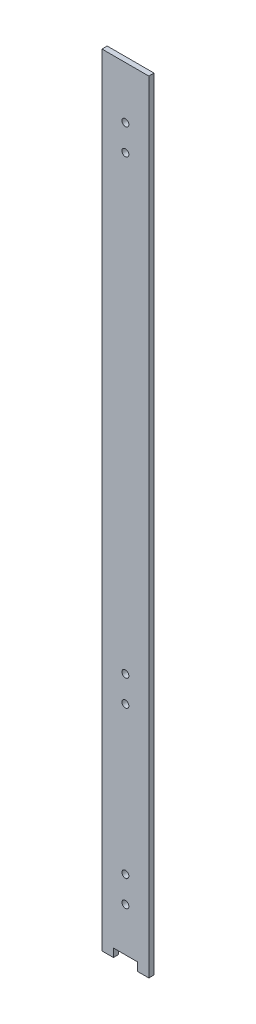
from build123d import *

# Parameters (mm, degrees)
SKETCH_1_W          = 27
SKETCH_1_H          = 3
EXTRUDE_1_DEPTH     = 450
SKETCH_2_W          = 13.830635844
SKETCH_2_H          = 9.55824336
CUT_EXTRUDE_1_DEPTH = 451.21244985
SKETCH_3_R          = 2
CUT_EXTRUDE_2_DEPTH = 451.21244985


with BuildPart() as part:
    # 草图1 → 凸台-拉伸1 (new body)
    with BuildSketch(Plane(origin=(0, 0, 0), x_dir=(1, 0, 0), z_dir=(0, 1, 0))):
        Rectangle(SKETCH_1_W, SKETCH_1_H)
    extrude(amount=EXTRUDE_1_DEPTH)

    # 草图2 → 切除-拉伸1 (cut, through all)
    with BuildSketch(Plane(origin=(0, 0, -1.5), x_dir=(-1, 0, 0), z_dir=(0, 0, -1))):
        Rectangle(SKETCH_2_W, SKETCH_2_H)
    extrude(amount=-CUT_EXTRUDE_1_DEPTH, mode=Mode.SUBTRACT)

    # 草图3 → 切除-拉伸2 (cut, through all)
    with BuildSketch(Plane(origin=(0, 0, -1.5), x_dir=(-1, 0, 0), z_dir=(0, 0, -1))):
        with Locations((0, 420)):
            Circle(SKETCH_3_R)
        with Locations((0, 405)):
            Circle(SKETCH_3_R)
        with Locations((0, 30)):
            Circle(SKETCH_3_R)
        with Locations((0, 45)):
            Circle(SKETCH_3_R)
        with Locations((0, 130)):
            Circle(SKETCH_3_R)
        with Locations((0, 145)):
            Circle(SKETCH_3_R)
    extrude(amount=-CUT_EXTRUDE_2_DEPTH, mode=Mode.SUBTRACT)


solid = part.part
